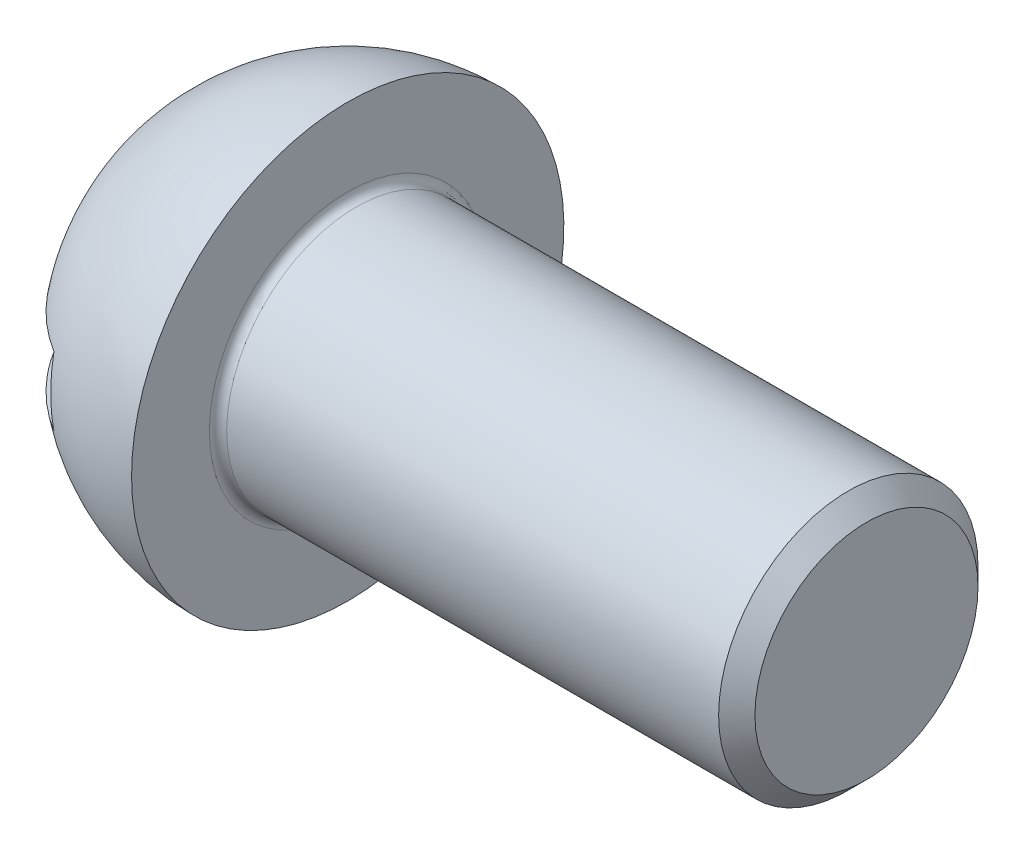
from build123d import *

# Parameters (mm, degrees)
ZKOSIT1_SIZE             = 0.21
ZAOBLIT1_R               = 0.1
SKICA3_W                 = 5
SKICA3_H                 = 0.8
ODEBRAT_VYSUNUT_M2_DEPTH = 1.2


with BuildPart() as part:
    # Skica1 → Otočit kolem osy1 (revolve)
    with BuildSketch(Plane(origin=(0, 0, 0), x_dir=(1, 0, 0), z_dir=(0, 1, 0))):
        with BuildLine():
            Line((2.5, 2.5), (2.5, 1.5))
            Line((2.5, 1.5), (8.5, 1.5))
            Line((8.5, 1.5), (8.5, 0))
            Line((8.5, 0), (0, 0))
            ThreePointArc((0, 0), (0.732233047, 1.767766953), (2.5, 2.5))
        make_face()
    revolve(axis=Axis((0, 0, 0), (1, 0, 0)))

    # Zkosit1
    zkosit1_edges = [part.edges().sort_by_distance(p)[0] for p in [
        (8.5, 0, 1.5),
    ]]
    chamfer(zkosit1_edges, length=ZKOSIT1_SIZE)

    # Zaoblit1
    zaoblit1_edges = [part.edges().sort_by_distance(p)[0] for p in [
        (2.5, 0, 1.5),
    ]]
    fillet(zaoblit1_edges, radius=ZAOBLIT1_R)

    # Skica3 → Odebrat vysunutím2 (cut)
    with BuildSketch(Plane(origin=(0, 0, 0), x_dir=(0, 0, -1), z_dir=(1, 0, 0))):
        Rectangle(SKICA3_W, SKICA3_H)
    extrude(amount=ODEBRAT_VYSUNUT_M2_DEPTH, mode=Mode.SUBTRACT)


solid = part.part
